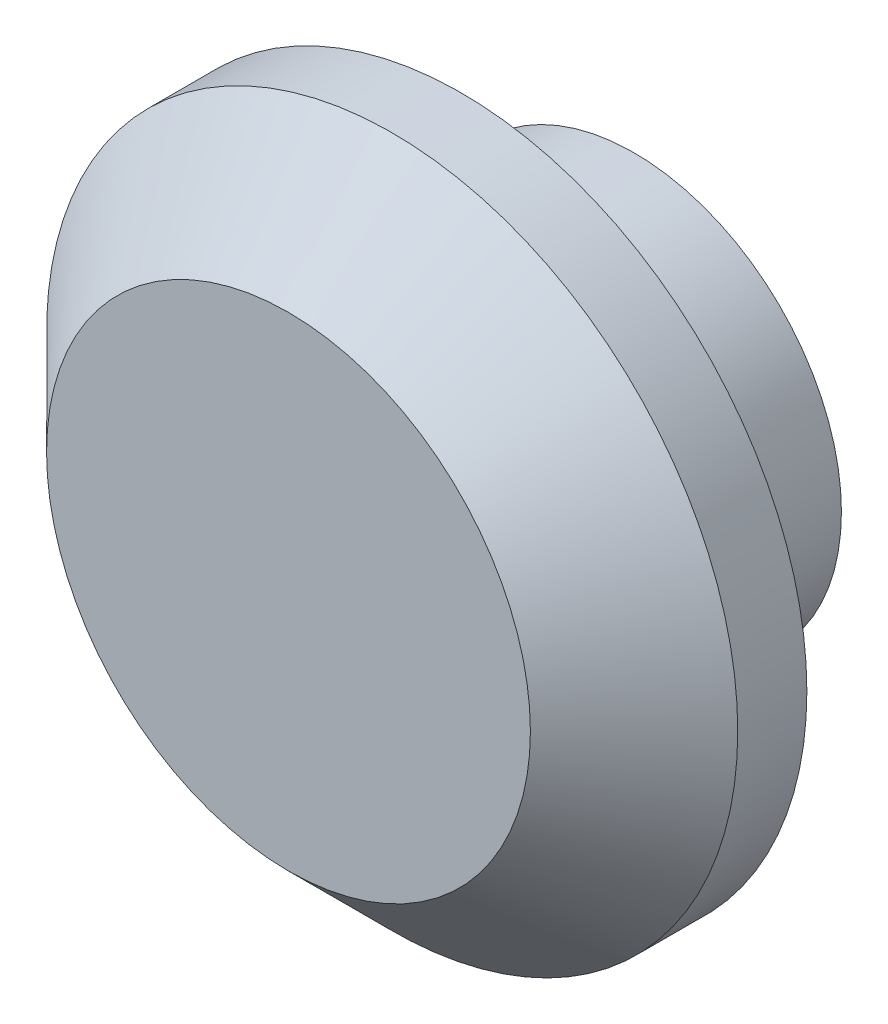
from build123d import *

# Parameters (mm, degrees)
BOSS_EXTRUDE1_DEPTH      = 5
BOSS_EXTRUDE1_DEPTH_BACK = 5
SKETCH1_R                = 6
SKETCH1_R_2              = 3.25
SKETCH2_R                = 10.000000149
BOSS_EXTRUDE2_DEPTH      = 5
CHAMFER1_SIZE            = 3


with BuildPart() as part:
    # Sketch1 → Boss-Extrude1 (new, two sides: drawn at the far end of the back side and taken through both)
    with BuildSketch(Plane.XY.offset(-BOSS_EXTRUDE1_DEPTH_BACK)):
        Circle(SKETCH1_R)
        Circle(SKETCH1_R_2, mode=Mode.SUBTRACT)
    extrude(amount=BOSS_EXTRUDE1_DEPTH + BOSS_EXTRUDE1_DEPTH_BACK)

    # Sketch2 → Boss-Extrude2 (add)
    with BuildSketch(Plane.XY):
        Circle(SKETCH2_R)
    extrude(amount=BOSS_EXTRUDE2_DEPTH)

    # Chamfer1
    chamfer1_edges = [part.edges().sort_by_distance(p)[0] for p in [
        (-10.000000149, 0, 5),
    ]]
    chamfer(chamfer1_edges, length=CHAMFER1_SIZE)


solid = part.part
